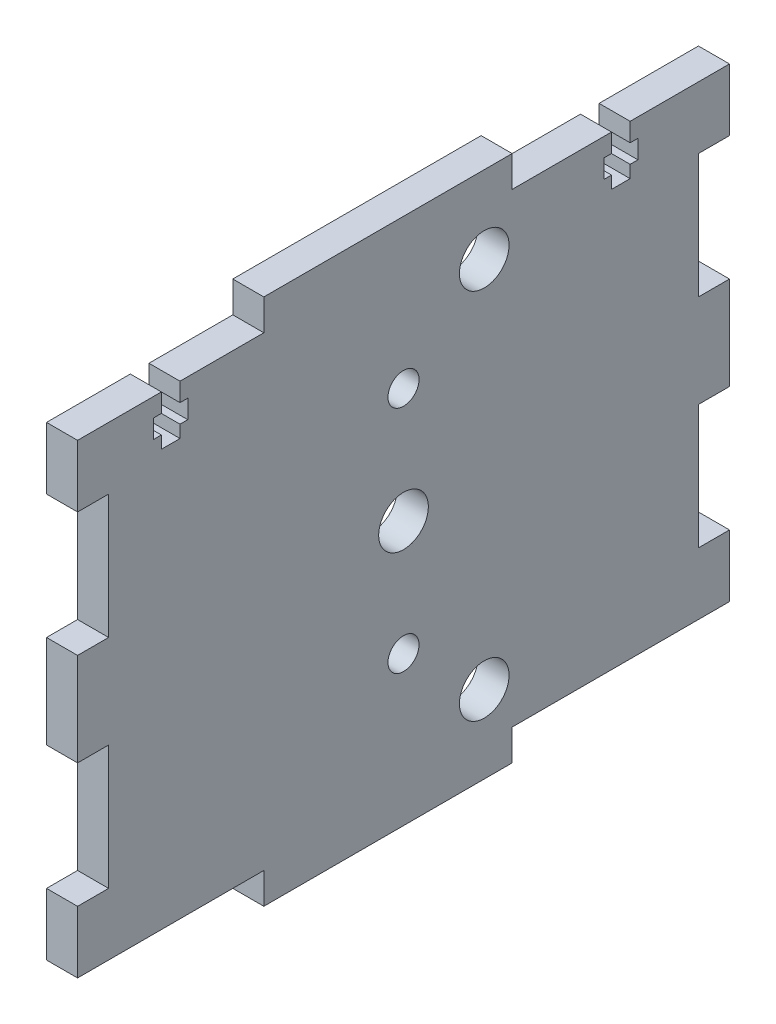
from build123d import *

# Parameters (mm, degrees)
SKETCH_1_R      = 4
SKETCH_1_R_2    = 2.5
EXTRUDE_1_DEPTH = 5


with BuildPart() as part:
    # 草图1 → 凸台-拉伸1 (new body)
    with BuildSketch(Plane(origin=(0, 0, 0), x_dir=(0, 0, -1), z_dir=(1, 0, 0))):
        Polygon((-62.127361451, 56.787762609), (-75.627361451, 56.787762609), (-75.627361451, 53.787762609), (-74.377361451, 53.787762609), (-74.377361451, 50.787762609), (-75.627361451, 50.787762609), (-75.627361451, 48.787762609), (-78.627361451, 48.787762609), (-78.627361451, 50.787762609), (-79.877361451, 50.787762609), (-79.877361451, 53.787762609), (-78.627361451, 53.787762609), (-78.627361451, 56.787762609), (-92.127361451, 56.787762609), (-92.127361451, 46.787762609), (-87.127361451, 46.787762609), (-87.127361451, 26.787762609), (-92.127361451, 26.787762609), (-92.127361451, 11.787762609), (-87.127361451, 11.787762609), (-87.127361451, -8.212237391), (-92.127361451, -8.212237391), (-92.127361451, -18.212237391), (-62.127361451, -18.212237391), (-62.127361451, -23.212237391), (-22.127361451, -23.212237391), (-22.127361451, -18.212237391), (12.872638549, -18.212237391), (12.872638549, -8.212237391), (7.872638549, -8.212237391), (7.872638549, 11.787762609), (12.872638549, 11.787762609), (12.872638549, 26.787762609), (7.872638549, 26.787762609), (7.872638549, 46.787762609), (12.872638549, 46.787762609), (12.872638549, 56.787762609), (-3.127361451, 56.787762609), (-3.127361451, 53.787762609), (-1.877361451, 53.787762609), (-1.877361451, 50.787762609), (-3.127361451, 50.787762609), (-3.127361451, 48.787762609), (-6.127361451, 48.787762609), (-6.127361451, 50.787762609), (-7.377361451, 50.787762609), (-7.377361451, 53.787762609), (-6.127361451, 53.787762609), (-6.127361451, 56.787762609), (-22.127361451, 56.787762609), (-22.127361451, 61.787762609), (-62.127361451, 61.787762609), align=None)
        with Locations((-39.627361451, 19.287762609)):
            Circle(SKETCH_1_R, mode=Mode.SUBTRACT)
        with Locations((-39.627361451, 37.787762609)):
            Circle(SKETCH_1_R_2, mode=Mode.SUBTRACT)
        with Locations((-39.627361451, 0.787762609)):
            Circle(SKETCH_1_R_2, mode=Mode.SUBTRACT)
        with Locations((-26.627361451, 49.287762609)):
            Circle(SKETCH_1_R, mode=Mode.SUBTRACT)
        with Locations((-26.627361451, -10.712237391)):
            Circle(SKETCH_1_R, mode=Mode.SUBTRACT)
    extrude(amount=EXTRUDE_1_DEPTH)


solid = part.part
